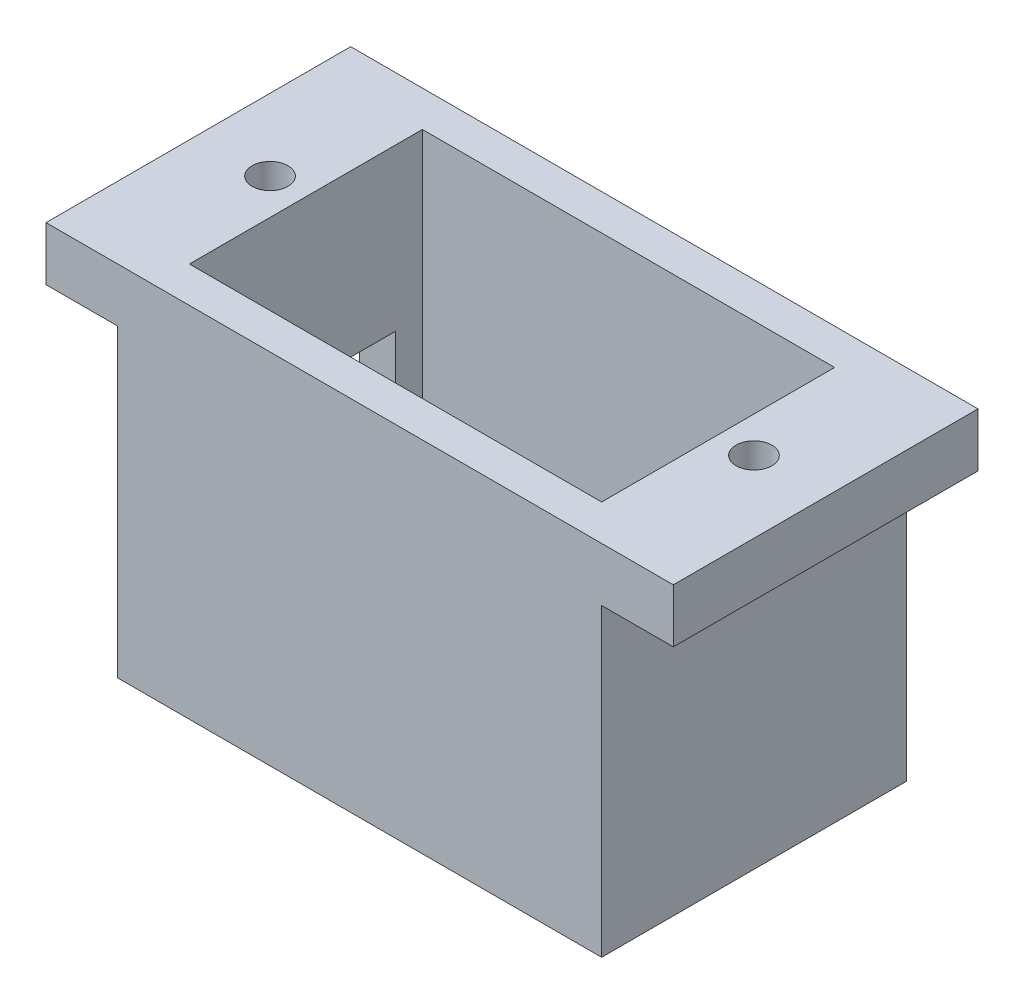
from build123d import *

# Parameters (mm, degrees)
SKETCH1_W           = 27
SKETCH1_H           = 17
SKETCH1_W_2         = 23
SKETCH1_H_2         = 13
BOSS_EXTRUDE1_DEPTH = 18
SKETCH1_2_W         = 27
SKETCH1_2_H         = 17
BOSS_EXTRUDE2_DEPTH = 2
SKETCH2_R           = 1.5
CUT_EXTRUDE1_DEPTH  = 2
SKETCH3_W           = 10
SKETCH3_H           = 5
CUT_EXTRUDE2_DEPTH  = 3
SKETCH4_W           = 4
SKETCH4_H           = 17
BOSS_EXTRUDE3_DEPTH = 3
SKETCH5_R           = 1
CUT_EXTRUDE3_DEPTH  = 5


with BuildPart() as part:
    # Sketch1 → Boss-Extrude1 (new body)
    with BuildSketch(Plane(origin=(0, 0, 0), x_dir=(1, 0, 0), z_dir=(0, 1, 0))):
        Rectangle(SKETCH1_W, SKETCH1_H)
        Rectangle(SKETCH1_W_2, SKETCH1_H_2, mode=Mode.SUBTRACT)
    extrude(amount=BOSS_EXTRUDE1_DEPTH)

    # Sketch1<2> → Boss-Extrude2 (add)
    with BuildSketch(Plane(origin=(0, 0, 0), x_dir=(1, 0, 0), z_dir=(0, 1, 0))):
        Rectangle(SKETCH1_2_W, SKETCH1_2_H)
    extrude(amount=-BOSS_EXTRUDE2_DEPTH)

    # Sketch2 → Cut-Extrude1 (cut)
    with BuildSketch(Plane(origin=(0, 0, 0), x_dir=(1, 0, 0), z_dir=(0, 1, 0))):
        with Locations((-6, 0)):
            Circle(SKETCH2_R)
        Circle(SKETCH2_R)
        with Locations((6, 0)):
            Circle(SKETCH2_R)
    extrude(amount=-CUT_EXTRUDE1_DEPTH, mode=Mode.SUBTRACT)

    # Sketch3 → Cut-Extrude2 (cut)
    with BuildSketch(Plane.ZY.offset(13.5)):
        with Locations((0, 6.5)):
            Rectangle(SKETCH3_W, SKETCH3_H)
    extrude(amount=-CUT_EXTRUDE2_DEPTH, mode=Mode.SUBTRACT)

    # Sketch4 → Boss-Extrude3 (add)
    with BuildSketch(Plane(origin=(0, 18, 0), x_dir=(1, 0, 0), z_dir=(0, 1, 0))):
        with Locations((15.5, 0)):
            Rectangle(SKETCH4_W, SKETCH4_H)
        with Locations((-15.5, 0)):
            Rectangle(SKETCH4_W, SKETCH4_H)
    extrude(amount=-BOSS_EXTRUDE3_DEPTH)

    # Sketch5 → Cut-Extrude3 (cut)
    with BuildSketch(Plane(origin=(0, 18, 0), x_dir=(1, 0, 0), z_dir=(0, 1, 0))):
        with Locations((-13.5, 0)):
            Circle(SKETCH5_R)
        with Locations((13.5, 0)):
            Circle(SKETCH5_R)
    extrude(amount=-CUT_EXTRUDE3_DEPTH, mode=Mode.SUBTRACT)


solid = part.part
